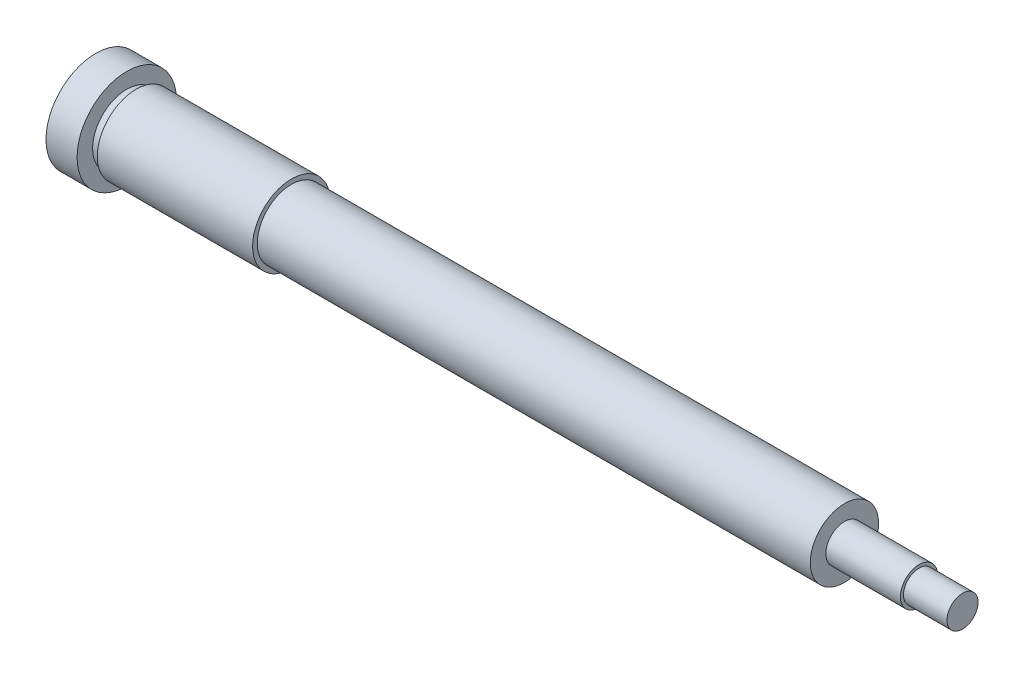
from build123d import *


with BuildPart() as part:
    # Sketch1 → Revolve1 (revolve)
    with BuildSketch(Plane.XY, mode=Mode.PRIVATE) as revolve1_sk:
        Polygon((-279, 0), (-279, 16), (-269, 16), (-269, 11), (-266, 11), (-266, 12.5), (-216, 12.5), (-216, 11), (-38, 11), (-38, 6), (-14, 6), (-14, 5), (0, 5), (0, 0), align=None)
    revolve(revolve1_sk.sketch.rotate(Axis((-279, 0, 0), (1, 0, 0)), 90), axis=Axis((-279, 0, 0), (1, 0, 0)))


solid = part.part
